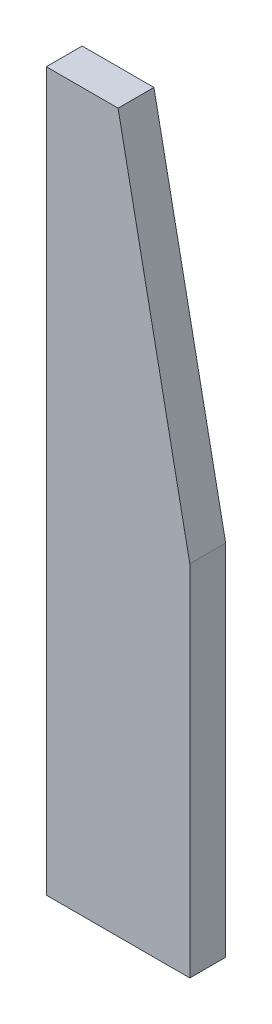
from build123d import *

# Parameters (mm, degrees)
SKETCH1_W                    = 6.35
SKETCH1_H                    = 127
BOSS_EXTRUDE1_DEPTH          = 25.4
M2_5X0_45_TAPPED_HOLE1_D     = 2.05
M2_5X0_45_TAPPED_HOLE1_DEPTH = 6.35
M2_5X0_45_TAPPED_HOLE1_TIP   = 0.615882135
CUT_EXTRUDE1_DEPTH           = 69.685751798
CUT_EXTRUDE1_DEPTH_BACK      = 69.685751798


with BuildPart() as part:
    # Sketch1 → Boss-Extrude1 (new body)
    with BuildSketch(Plane(origin=(0, 0, 0), x_dir=(0, 0, -1), z_dir=(1, 0, 0))):
        Rectangle(SKETCH1_W, SKETCH1_H)
    extrude(amount=BOSS_EXTRUDE1_DEPTH)

    # M2.5x0.45 Tapped Hole1
    with Locations(Plane.ZY):
        with Locations((0, 53.5), (0, 26.75), (0, 0), (0, -26.75), (0, -53.5)):
            Hole(M2_5X0_45_TAPPED_HOLE1_D / 2, depth=M2_5X0_45_TAPPED_HOLE1_DEPTH)
            with Locations((0, 0, -(M2_5X0_45_TAPPED_HOLE1_DEPTH + M2_5X0_45_TAPPED_HOLE1_TIP / 2))):  # 118° drill point
                Cone(0, M2_5X0_45_TAPPED_HOLE1_D / 2, M2_5X0_45_TAPPED_HOLE1_TIP, mode=Mode.SUBTRACT)

    # Sketch4 → Cut-Extrude1 (cut, two sides: drawn at the far end of the back side and taken through both)
    with BuildSketch(Plane.XY.offset(3.175).offset(-CUT_EXTRUDE1_DEPTH_BACK)):
        Polygon((25.4, 63.5), (12.7, 63.5), (25.4, 0), align=None)
    extrude(amount=CUT_EXTRUDE1_DEPTH + CUT_EXTRUDE1_DEPTH_BACK, mode=Mode.SUBTRACT)


solid = part.part
